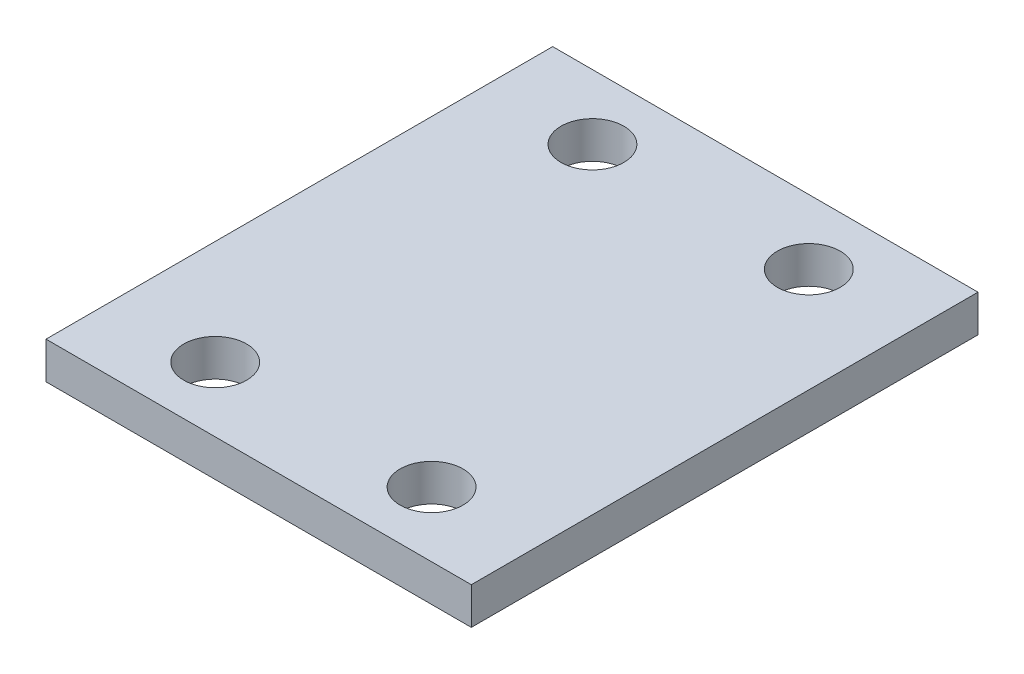
from build123d import *

# Parameters (mm, degrees)
SKETCH1_W           = 23
SKETCH1_H           = 27.4
SKETCH1_R           = 1.7
BOSS_EXTRUDE1_DEPTH = 2


with BuildPart() as part:
    # Sketch1 → Boss-Extrude1 (new body)
    with BuildSketch(Plane(origin=(0, 0, 0), x_dir=(1, 0, 0), z_dir=(0, 1, 0))):
        Rectangle(SKETCH1_W, SKETCH1_H)
        with Locations(Location((5.85, 10.2, 0), (0, 0, 270))):
            Circle(SKETCH1_R, mode=Mode.SUBTRACT)
        with Locations(Location((-5.85, 10.2, 0), (0, 0, 270))):
            Circle(SKETCH1_R, mode=Mode.SUBTRACT)
        with Locations(Location((5.85, -10.2, 0), (0, 0, 270))):
            Circle(SKETCH1_R, mode=Mode.SUBTRACT)
        with Locations(Location((-5.85, -10.2, 0), (0, 0, 270))):
            Circle(SKETCH1_R, mode=Mode.SUBTRACT)
    extrude(amount=-BOSS_EXTRUDE1_DEPTH)


solid = part.part
